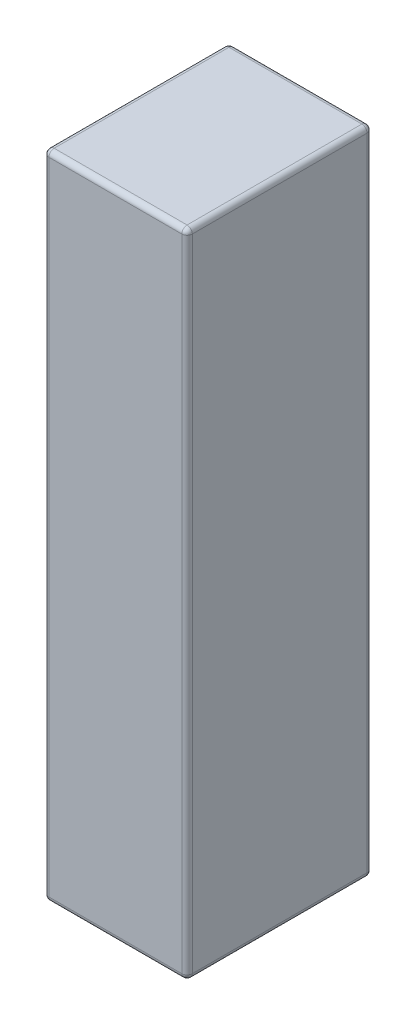
from build123d import *

# Parameters (mm, degrees)
SKETCH1_W           = 13.7
SKETCH1_H           = 17.7
BOSS_EXTRUDE1_DEPTH = 62.2
FILLET1_R           = 0.5


with BuildPart() as part:
    # Sketch1 → Boss-Extrude1 (new body)
    with BuildSketch(Plane(origin=(0, 0, 0), x_dir=(1, 0, 0), z_dir=(0, 1, 0))):
        with Locations((6.85, 8.85)):
            Rectangle(SKETCH1_W, SKETCH1_H)
    extrude(amount=BOSS_EXTRUDE1_DEPTH)

    # Fillet1
    fillet1_edges = [part.edges().sort_by_distance(p)[0] for p in [
        (13.7, 62.2, -8.85),
        (6.85, 62.2, -17.7),
        (0, 62.2, -8.85),
        (6.85, 0, -17.7),
        (13.7, 0, -8.85),
        (6.85, 0, 0),
        (0, 0, -8.85),
        (0, 31.1, -17.7),
        (13.7, 31.1, -17.7),
        (13.7, 31.1, 0),
        (0, 31.1, 0),
        (6.85, 62.2, 0),
    ]]
    fillet(fillet1_edges, radius=FILLET1_R)


solid = part.part
